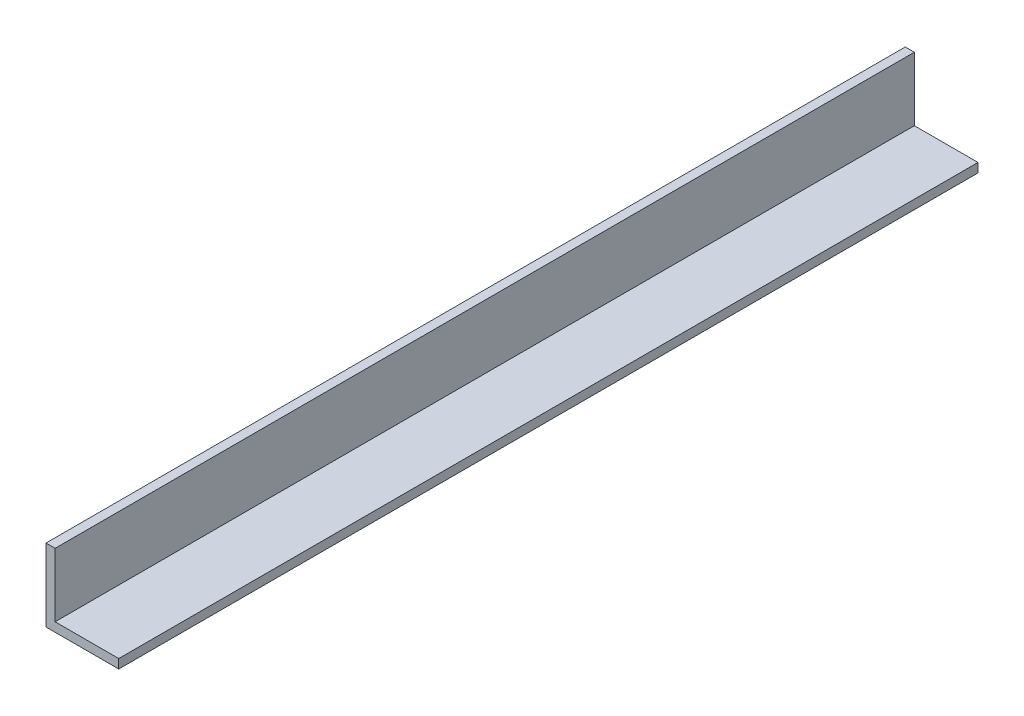
from build123d import *

# Parameters (mm, degrees)
RESSALTO_EXTRUS_O1_DEPTH = 300


with BuildPart() as part:
    # Esboço1 → Ressalto-extrusão1 (new body)
    with BuildSketch(Plane.XY):
        Polygon((0, 0), (25.4, 0), (25.4, 3.18), (3.18, 3.18), (3.18, 25.4), (0, 25.4), align=None)
    extrude(amount=RESSALTO_EXTRUS_O1_DEPTH)


solid = part.part
